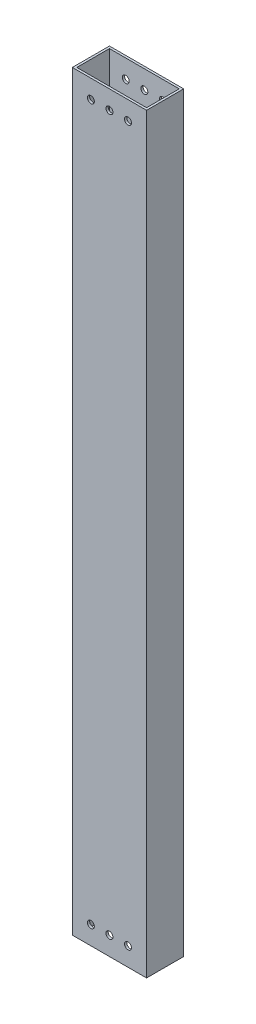
from build123d import *

# Parameters (mm, degrees)
SKETCH1_W               = 50.8
SKETCH1_H               = 25.4
SKETCH1_W_2             = 47.752
SKETCH1_H_2             = 22.352
EXTRUDE_THIN1_DEPTH     = 514.35
CUT_EXTRUDE1_DEPTH      = 518.47630139
CUT_EXTRUDE1_DEPTH_BACK = 518.47630139
SKETCH2_R               = 2.38125


with BuildPart() as part:
    # Sketch1 → Extrude-Thin1 (new body)
    with BuildSketch(Plane(origin=(0, 0, 0), x_dir=(1, 0, 0), z_dir=(0, 1, 0))):
        with Locations((-25.4, -12.7)):
            Rectangle(SKETCH1_W, SKETCH1_H)
        with Locations((-25.4, -12.7)):
            Rectangle(SKETCH1_W_2, SKETCH1_H_2, mode=Mode.SUBTRACT)
    extrude(amount=EXTRUDE_THIN1_DEPTH)

    # Sketch2 → Cut-Extrude1 (cut, two sides: drawn at the far end of the back side and taken through both)
    with BuildSketch(Plane.XY.offset(25.4).offset(-CUT_EXTRUDE1_DEPTH_BACK)):
        with Locations(Location((-38.1, 12.7, 0), (0, 0, 180))):
            Circle(SKETCH2_R)
        with Locations(Location((-25.4, 12.7, 0), (0, 0, 180))):
            Circle(SKETCH2_R)
        with Locations(Location((-12.7, 12.7, 0), (0, 0, 180))):
            Circle(SKETCH2_R)
        with Locations(Location((-38.1, 501.65, 0), (0, 0, 180))):
            Circle(SKETCH2_R)
        with Locations(Location((-25.4, 501.65, 0), (0, 0, 180))):
            Circle(SKETCH2_R)
        with Locations(Location((-12.7, 501.65, 0), (0, 0, 180))):
            Circle(SKETCH2_R)
    extrude(amount=CUT_EXTRUDE1_DEPTH + CUT_EXTRUDE1_DEPTH_BACK, mode=Mode.SUBTRACT)


solid = part.part
